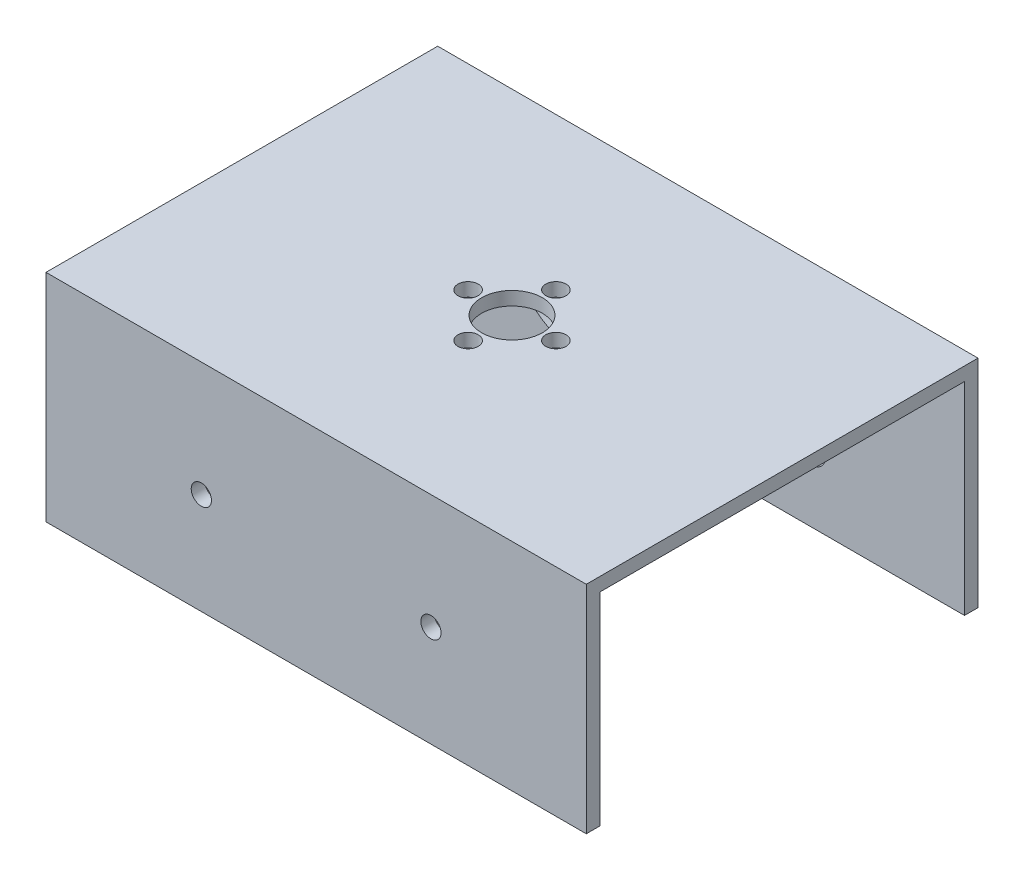
from build123d import *

# Parameters (mm, degrees)
SKETCH_1_W          = 80
SKETCH_1_H          = 30
EXTRUDE_1_DEPTH     = 2
SKETCH_2_W          = 80
SKETCH_2_H          = 58
EXTRUDE_2_DEPTH     = 2
SKETCH_3_W          = 80
SKETCH_3_H          = 2
EXTRUDE_3_DEPTH     = 30
CUT_EXTRUDE_1_REACH = 77.895
SKETCH_5_R          = 4.5
SKETCH_5_R_2        = 1.5
CUT_EXTRUDE_3_REACH = 74.478
SKETCH_6_R          = 1.5
CUT_EXTRUDE_4_REACH = 74.478
SKETCH_7_R          = 10
CUT_EXTRUDE_5_REACH = 72.887
SKETCH_8_R          = 2
CUT_EXTRUDE_6_REACH = 72.887
SKETCH_9_R          = 2


with BuildPart() as part:
    # 草图1 → 凸台-拉伸1 (new body)
    with BuildSketch(Plane.XY):
        Rectangle(SKETCH_1_W, SKETCH_1_H)
    extrude(amount=EXTRUDE_1_DEPTH)

    # 草图2 → 凸台-拉伸2 (add)
    with BuildSketch(Plane(origin=(0, 15, 0), x_dir=(1, 0, 0), z_dir=(0, 1, 0))):
        with Locations((0, 27)):
            Rectangle(SKETCH_2_W, SKETCH_2_H)
    extrude(amount=EXTRUDE_2_DEPTH)

    # 草图3 → 凸台-拉伸3 (add)
    with BuildSketch(Plane.XZ.offset(-15)):
        with Locations((0, -55)):
            Rectangle(SKETCH_3_W, SKETCH_3_H)
    extrude(amount=EXTRUDE_3_DEPTH)

    # 草图5 → 切除-拉伸1 (cut, up to next)
    with BuildSketch(Plane(origin=(0, 17, 0), x_dir=(1, 0, 0), z_dir=(0, 1, 0)), mode=Mode.PRIVATE) as cut_extrude_1_sk1:
        with Locations(Location((0, 27, 0), (0, 0, 270))):
            Circle(SKETCH_5_R)
    cut_extrude_1_tool1 = extrude(cut_extrude_1_sk1.sketch, amount=-CUT_EXTRUDE_1_REACH, mode=Mode.PRIVATE) & part.part
    # 草图5 → 切除-拉伸1 (cut, up to next)
    with BuildSketch(Plane(origin=(0, 17, 0), x_dir=(1, 0, 0), z_dir=(0, 1, 0)), mode=Mode.PRIVATE) as cut_extrude_1_sk2:
        with Locations(Location((-6.5, 27, 0), (0, 0, 270))):
            Circle(SKETCH_5_R_2)
    cut_extrude_1_tool2 = extrude(cut_extrude_1_sk2.sketch, amount=-CUT_EXTRUDE_1_REACH, mode=Mode.PRIVATE) & part.part
    # 草图5 → 切除-拉伸1 (cut, up to next)
    with BuildSketch(Plane(origin=(0, 17, 0), x_dir=(1, 0, 0), z_dir=(0, 1, 0)), mode=Mode.PRIVATE) as cut_extrude_1_sk3:
        with Locations(Location((6.5, 27, 0), (0, 0, 270))):
            Circle(SKETCH_5_R_2)
    cut_extrude_1_tool3 = extrude(cut_extrude_1_sk3.sketch, amount=-CUT_EXTRUDE_1_REACH, mode=Mode.PRIVATE) & part.part
    # 草图5 → 切除-拉伸1 (cut, up to next)
    with BuildSketch(Plane(origin=(0, 17, 0), x_dir=(1, 0, 0), z_dir=(0, 1, 0)), mode=Mode.PRIVATE) as cut_extrude_1_sk4:
        with Locations(Location((0, 33.5, 0), (0, 0, 270))):
            Circle(SKETCH_5_R_2)
    cut_extrude_1_tool4 = extrude(cut_extrude_1_sk4.sketch, amount=-CUT_EXTRUDE_1_REACH, mode=Mode.PRIVATE) & part.part
    # 草图5 → 切除-拉伸1 (cut, up to next)
    with BuildSketch(Plane(origin=(0, 17, 0), x_dir=(1, 0, 0), z_dir=(0, 1, 0)), mode=Mode.PRIVATE) as cut_extrude_1_sk5:
        with Locations(Location((0, 20.5, 0), (0, 0, 270))):
            Circle(SKETCH_5_R_2)
    cut_extrude_1_tool5 = extrude(cut_extrude_1_sk5.sketch, amount=-CUT_EXTRUDE_1_REACH, mode=Mode.PRIVATE) & part.part
    add(cut_extrude_1_tool1.solids().sort_by_distance((0, 17, -27))[0], mode=Mode.SUBTRACT)
    add(cut_extrude_1_tool2.solids().sort_by_distance((-6.5, 17, -27))[0], mode=Mode.SUBTRACT)
    add(cut_extrude_1_tool3.solids().sort_by_distance((6.5, 17, -27))[0], mode=Mode.SUBTRACT)
    add(cut_extrude_1_tool4.solids().sort_by_distance((0, 17, -33.5))[0], mode=Mode.SUBTRACT)
    add(cut_extrude_1_tool5.solids().sort_by_distance((0, 17, -20.5))[0], mode=Mode.SUBTRACT)

    # 切除-拉伸3: up to this face of the body (flat: up to its plane)
    cut_extrude_3_end = Plane(part.part.faces().sort_by_distance((0, 1, 2))[0])
    # 草图6 → 切除-拉伸3 (cut, up to the picked face)
    with BuildSketch(Plane(origin=(0, 0, -56), x_dir=(-1, 0, 0), z_dir=(0, 0, -1)), mode=Mode.PRIVATE) as cut_extrude_3_sk1:
        with Locations((-17, 0)):
            Circle(SKETCH_6_R)
    cut_extrude_3_tool1 = split(extrude(cut_extrude_3_sk1.sketch, amount=-CUT_EXTRUDE_3_REACH, mode=Mode.PRIVATE), bisect_by=cut_extrude_3_end, keep=Keep.BOTH, mode=Mode.PRIVATE)
    # 草图6 → 切除-拉伸3 (cut, up to the picked face)
    with BuildSketch(Plane(origin=(0, 0, -56), x_dir=(-1, 0, 0), z_dir=(0, 0, -1)), mode=Mode.PRIVATE) as cut_extrude_3_sk2:
        with Locations((17, 0)):
            Circle(SKETCH_6_R)
    cut_extrude_3_tool2 = split(extrude(cut_extrude_3_sk2.sketch, amount=-CUT_EXTRUDE_3_REACH, mode=Mode.PRIVATE), bisect_by=cut_extrude_3_end, keep=Keep.BOTH, mode=Mode.PRIVATE)
    add(cut_extrude_3_tool1.solids().sort_by(Axis((17, 0, -56), (0, 0, 1)))[0], mode=Mode.SUBTRACT)
    add(cut_extrude_3_tool2.solids().sort_by(Axis((-17, 0, -56), (0, 0, 1)))[0], mode=Mode.SUBTRACT)

    # 草图7 → 切除-拉伸4 (cut, up to next)
    with BuildSketch(Plane(origin=(0, 0, -56), x_dir=(-1, 0, 0), z_dir=(0, 0, -1)), mode=Mode.PRIVATE) as cut_extrude_4_sk1:
        with Locations((17, 0)):
            Circle(SKETCH_7_R)
    cut_extrude_4_tool1 = extrude(cut_extrude_4_sk1.sketch, amount=-CUT_EXTRUDE_4_REACH, mode=Mode.PRIVATE) & part.part
    add(cut_extrude_4_tool1.solids().sort_by_distance((-17, 0, -56))[0], mode=Mode.SUBTRACT)

    # 草图8 → 切除-拉伸5 (cut, up to next)
    with BuildSketch(Plane.XY.offset(-54), mode=Mode.PRIVATE) as cut_extrude_5_sk1:
        with Locations((17.42, 5)):
            Circle(SKETCH_8_R)
    cut_extrude_5_tool1 = extrude(cut_extrude_5_sk1.sketch, amount=-CUT_EXTRUDE_5_REACH, mode=Mode.PRIVATE) & part.part
    # 草图8 → 切除-拉伸5 (cut, up to next)
    with BuildSketch(Plane.XY.offset(-54), mode=Mode.PRIVATE) as cut_extrude_5_sk2:
        with Locations((17.42, -5)):
            Circle(SKETCH_8_R)
    cut_extrude_5_tool2 = extrude(cut_extrude_5_sk2.sketch, amount=-CUT_EXTRUDE_5_REACH, mode=Mode.PRIVATE) & part.part
    add(cut_extrude_5_tool1.solids().sort_by_distance((17.42, 5, -54))[0], mode=Mode.SUBTRACT)
    add(cut_extrude_5_tool2.solids().sort_by_distance((17.42, -5, -54))[0], mode=Mode.SUBTRACT)

    # 草图9 → 切除-拉伸6 (cut, up to next)
    with BuildSketch(Plane.XY.offset(-54), mode=Mode.PRIVATE) as cut_extrude_6_sk1:
        with Locations((-32.07, 5)):
            Circle(SKETCH_9_R)
    cut_extrude_6_tool1 = extrude(cut_extrude_6_sk1.sketch, amount=-CUT_EXTRUDE_6_REACH, mode=Mode.PRIVATE) & part.part
    # 草图9 → 切除-拉伸6 (cut, up to next)
    with BuildSketch(Plane.XY.offset(-54), mode=Mode.PRIVATE) as cut_extrude_6_sk2:
        with Locations((-32.07, -5)):
            Circle(SKETCH_9_R)
    cut_extrude_6_tool2 = extrude(cut_extrude_6_sk2.sketch, amount=-CUT_EXTRUDE_6_REACH, mode=Mode.PRIVATE) & part.part
    add(cut_extrude_6_tool1.solids().sort_by_distance((-32.07, 5, -54))[0], mode=Mode.SUBTRACT)
    add(cut_extrude_6_tool2.solids().sort_by_distance((-32.07, -5, -54))[0], mode=Mode.SUBTRACT)


solid = part.part
